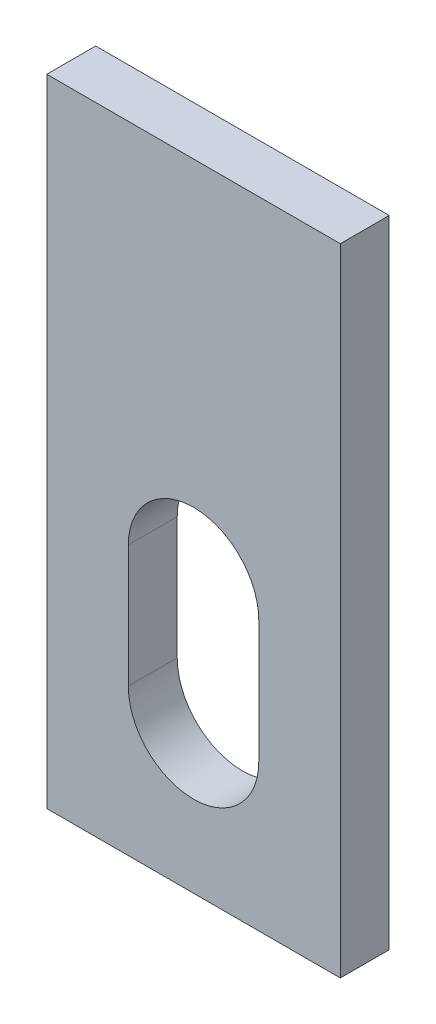
from build123d import *

# Parameters (mm, degrees)
SKETCH_1_W      = 60
SKETCH_1_H      = 130
EXTRUDE_3_DEPTH = 10


with BuildPart() as part:
    # 草图1 → 凸台-拉伸3 (new body)
    with BuildSketch(Plane.XY):
        with Locations((30, -65)):
            Rectangle(SKETCH_1_W, SKETCH_1_H)
        with BuildLine():
            Line((16.662515983, -100), (16.662515983, -75))
            ThreePointArc((16.662515983, -75), (30, -61.662515983), (43.337484017, -75))
            Line((43.337484017, -75), (43.337484017, -100))
            ThreePointArc((43.337484017, -100), (30, -113.337484017), (16.662515983, -100))
        make_face(mode=Mode.SUBTRACT)
    extrude(amount=EXTRUDE_3_DEPTH)


solid = part.part
